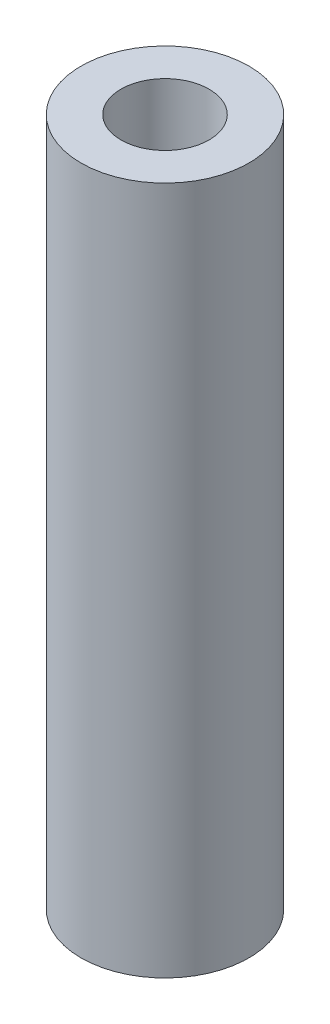
from build123d import *

# Parameters (mm, degrees)
SKETCH_1_R      = 3.05
SKETCH_1_R_2    = 1.6
EXTRUDE_1_DEPTH = 25


with BuildPart() as part:
    # ｽｹｯﾁ1 → ﾎﾞｽ - 押し出し1 (new body)
    with BuildSketch(Plane(origin=(0, 0, 0), x_dir=(1, 0, 0), z_dir=(0, 1, 0))):
        with Locations(Location((0, 0, 0), (0, 0, 270))):
            Circle(SKETCH_1_R)
        with Locations(Location((0, 0, 0), (0, 0, 270))):
            Circle(SKETCH_1_R_2, mode=Mode.SUBTRACT)
    extrude(amount=EXTRUDE_1_DEPTH)


solid = part.part
